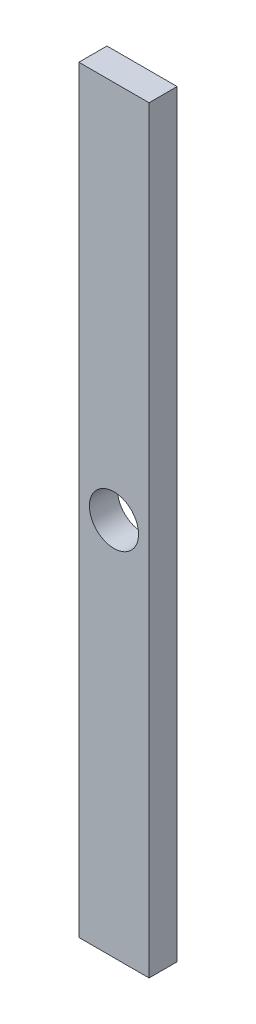
from build123d import *

# Parameters (mm, degrees)
SKETCH2_W           = 5
SKETCH2_H           = 54
BOSS_EXTRUDE1_DEPTH = 2
SKETCH3_R           = 1.75
CUT_EXTRUDE1_DEPTH  = 10


with BuildPart() as part:
    # Sketch2 → Boss-Extrude1 (new body)
    with BuildSketch(Plane.XY):
        Rectangle(SKETCH2_W, SKETCH2_H)
    extrude(amount=BOSS_EXTRUDE1_DEPTH)

    # Sketch3 → Cut-Extrude1 (cut)
    with BuildSketch(Plane.XY.offset(2)):
        Circle(SKETCH3_R)
    extrude(amount=-CUT_EXTRUDE1_DEPTH, mode=Mode.SUBTRACT)


solid = part.part
